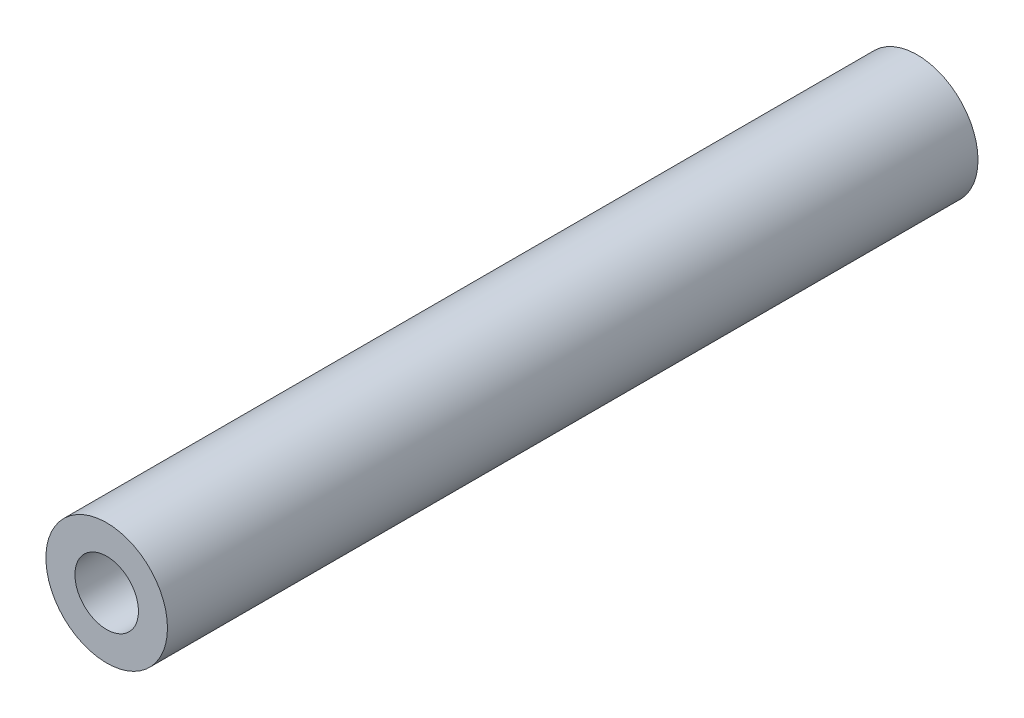
from build123d import *

# Parameters (mm, degrees)
SKETCH1_R           = 4.7625
SKETCH1_R_2         = 2.4892
BOSS_EXTRUDE1_DEPTH = 31.75


with BuildPart() as part:
    # Sketch1 → Boss-Extrude1 (new, symmetric)
    with BuildSketch(Plane.XY):
        Circle(SKETCH1_R)
        Circle(SKETCH1_R_2, mode=Mode.SUBTRACT)
    extrude(amount=BOSS_EXTRUDE1_DEPTH, both=True)


solid = part.part
